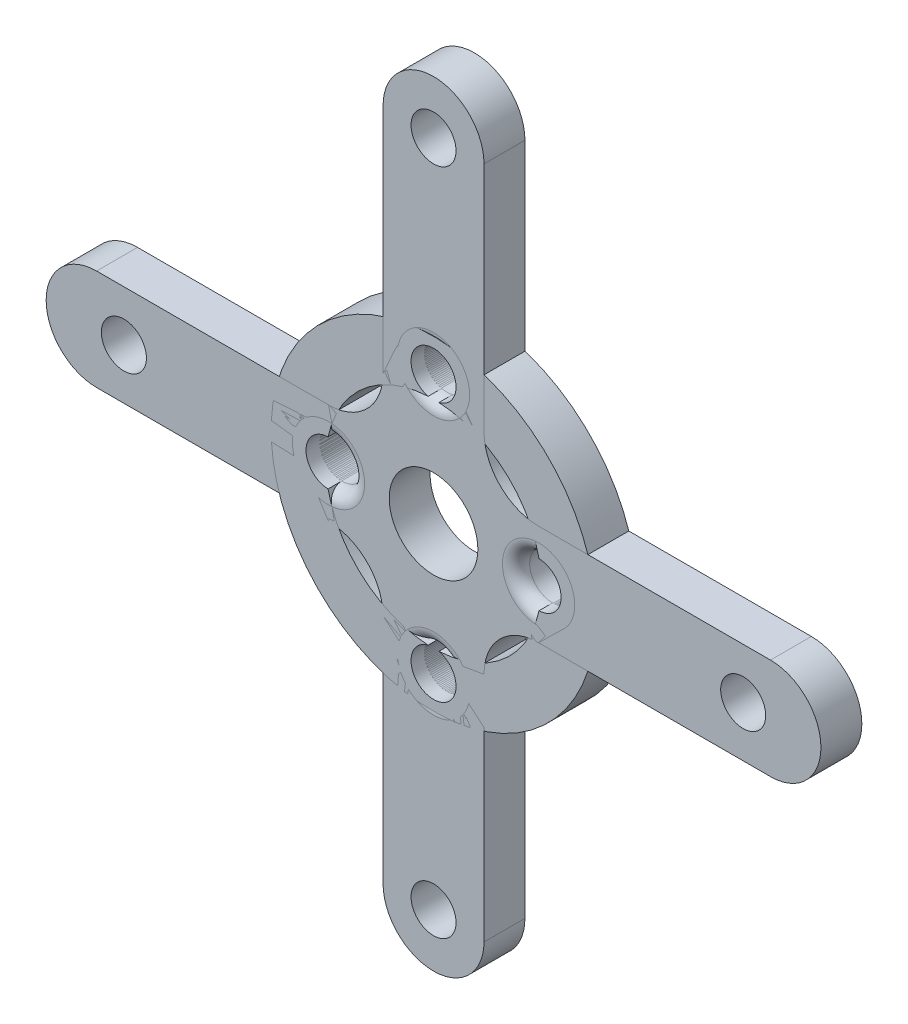
from build123d import *

# Parameters (mm, degrees)
SALIENTE_EXTRUIR2_DEPTH    = 3
CORTAR_EXTRUIR1_DEPTH      = 10
CORTAR_EXTRUIR1_DEPTH_BACK = 10
CROQUIS3_R                 = 3.25
CROQUIS3_R_2               = 1.65
CROQUIS1_15_R              = 11.907612282
CROQUIS1_15_R_2            = 7.907612282
SALIENTE_EXTRUIR3_DEPTH    = 3
CROQUIS3_2_R               = 3.25
CROQUIS3_2_R_2             = 1.65
CORTAR_EXTRUIR2_DEPTH      = 3
REDONDEO2_R                = 1
REDONDEO3_R                = 1
REDONDEO4_R                = 1
REDONDEO5_R                = 1


with BuildPart() as part:
    # Croquis1 → Saliente-Extruir2 (new body)
    with BuildSketch(Plane.XY):
        with BuildLine():
            Line((-7.7, 3.7), (-24.7, 3.7))
            ThreePointArc((-24.7, 3.7), (-28.4, 0), (-24.7, -3.7))
            Line((-24.7, -3.7), (-7.7, -3.7))
            ThreePointArc((-7.7, -3.7), (-4.871572875, -4.871572875), (-3.7, -7.7))
            Line((-3.7, -7.7), (-3.7, -24.7))
            ThreePointArc((-3.7, -24.7), (0, -28.4), (3.7, -24.7))
            Line((3.7, -24.7), (3.7, -7.7))
            ThreePointArc((3.7, -7.7), (4.871572875, -4.871572875), (7.7, -3.7))
            Line((7.7, -3.7), (24.7, -3.7))
            ThreePointArc((24.7, -3.7), (28.4, 0), (24.7, 3.7))
            Line((24.7, 3.7), (7.7, 3.7))
            ThreePointArc((7.7, 3.7), (4.871572875, 4.871572875), (3.7, 7.7))
            Line((3.7, 7.7), (3.7, 24.7))
            ThreePointArc((3.7, 24.7), (0, 28.4), (-3.7, 24.7))
            Line((-3.7, 24.7), (-3.7, 7.7))
            ThreePointArc((-3.7, 7.7), (-4.871572875, 4.871572875), (-7.7, 3.7))
        make_face()
    extrude(amount=SALIENTE_EXTRUIR2_DEPTH)

    # Croquis3 → Cortar-Extruir1 (cut, two sides: drawn at the far end of the back side and taken through both)
    with BuildSketch(Plane.XY.offset(3).offset(-CORTAR_EXTRUIR1_DEPTH_BACK)):
        Circle(CROQUIS3_R)
        with Locations((-7.7, 0)):
            Circle(CROQUIS3_R_2)
        with Locations((-22.7, 0)):
            Circle(CROQUIS3_R_2)
        with Locations((0, -9.5)):
            Circle(CROQUIS3_R_2)
        with Locations((7.7, 0)):
            Circle(CROQUIS3_R_2)
        with Locations((0, 9.5)):
            Circle(CROQUIS3_R_2)
        with Locations((0, 24.5)):
            Circle(CROQUIS3_R_2)
        with Locations((22.7, 0)):
            Circle(CROQUIS3_R_2)
        with Locations((0, -24.5)):
            Circle(CROQUIS3_R_2)
    extrude(amount=CORTAR_EXTRUIR1_DEPTH + CORTAR_EXTRUIR1_DEPTH_BACK, mode=Mode.SUBTRACT)

    # Redondeo2
    redondeo2_edges = [part.edges().sort_by_distance(p)[0] for p in [
        (-9.35, 0, 3),
    ]]
    fillet(redondeo2_edges, radius=REDONDEO2_R)

    # Redondeo3
    redondeo3_edges = [part.edges().sort_by_distance(p)[0] for p in [
        (-1.65, 9.5, 3),
    ]]
    fillet(redondeo3_edges, radius=REDONDEO3_R)

    # Redondeo4
    redondeo4_edges = [part.edges().sort_by_distance(p)[0] for p in [
        (6.05, 0, 3),
    ]]
    fillet(redondeo4_edges, radius=REDONDEO4_R)

    # Redondeo5
    redondeo5_edges = [part.edges().sort_by_distance(p)[0] for p in [
        (-1.65, -9.5, 3),
    ]]
    fillet(redondeo5_edges, radius=REDONDEO5_R)


with BuildPart() as body_2:
    # Croquis1<15> → Saliente-Extruir3 (new body)
    with BuildSketch(Plane.XY):
        Circle(CROQUIS1_15_R)
        Circle(CROQUIS1_15_R_2, mode=Mode.SUBTRACT)
    extrude(amount=SALIENTE_EXTRUIR3_DEPTH)

    # Croquis3<2> → Cortar-Extruir2 (cut)
    with BuildSketch(Plane.XY.offset(3)):
        Circle(CROQUIS3_2_R)
        with Locations((-7.7, 0)):
            Circle(CROQUIS3_2_R_2)
        with Locations((-22.7, 0)):
            Circle(CROQUIS3_2_R_2)
        with Locations((0, -9.5)):
            Circle(CROQUIS3_2_R_2)
        with Locations((7.7, 0)):
            Circle(CROQUIS3_2_R_2)
        with Locations((0, 9.5)):
            Circle(CROQUIS3_2_R_2)
        with Locations((0, 24.5)):
            Circle(CROQUIS3_2_R_2)
        with Locations((22.7, 0)):
            Circle(CROQUIS3_2_R_2)
        with Locations((0, -24.5)):
            Circle(CROQUIS3_2_R_2)
    extrude(amount=-CORTAR_EXTRUIR2_DEPTH, mode=Mode.SUBTRACT)


solid = Compound([part.part, body_2.part])
